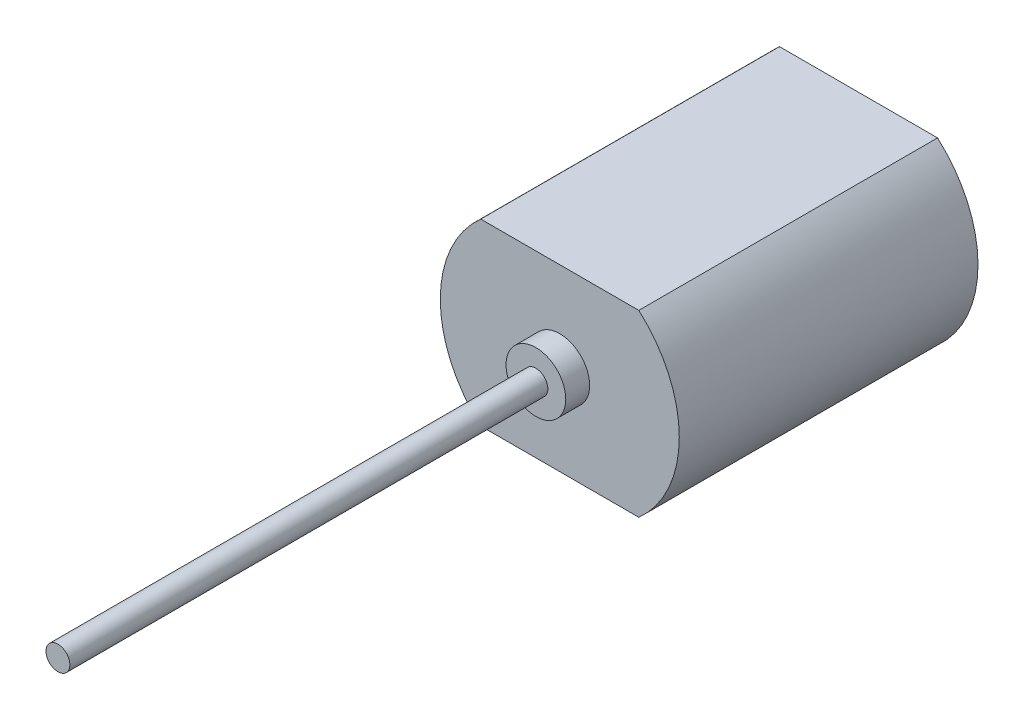
from build123d import *

# Parameters (mm, degrees)
BOSS_EXTRU_1_DEPTH = 12.5
ESQUISSE2_R        = 2.5
BOSS_EXTRU_2_DEPTH = 2
ESQUISSE3_R        = 1
BOSS_EXTRU_3_DEPTH = 40


with BuildPart() as part:
    # Esquisse1 → Boss.-Extru.1 (new, symmetric)
    with BuildSketch(Plane.XY):
        with BuildLine():
            Line((-6.614378278, 7.5), (6.614378278, 7.5))
            ThreePointArc((6.614378278, 7.5), (10, 0), (6.614378278, -7.5))
            Line((6.614378278, -7.5), (-6.614378278, -7.5))
            ThreePointArc((-6.614378278, -7.5), (-10, 0), (-6.614378278, 7.5))
        make_face()
    extrude(amount=BOSS_EXTRU_1_DEPTH, both=True)

    # Esquisse2 → Boss.-Extru.2 (add)
    with BuildSketch(Plane.XY.offset(12.5)):
        Circle(ESQUISSE2_R)
    extrude(amount=BOSS_EXTRU_2_DEPTH)

    # Esquisse3 → Boss.-Extru.3 (add)
    with BuildSketch(Plane.XY.offset(14.5)):
        Circle(ESQUISSE3_R)
    extrude(amount=BOSS_EXTRU_3_DEPTH)


solid = part.part
